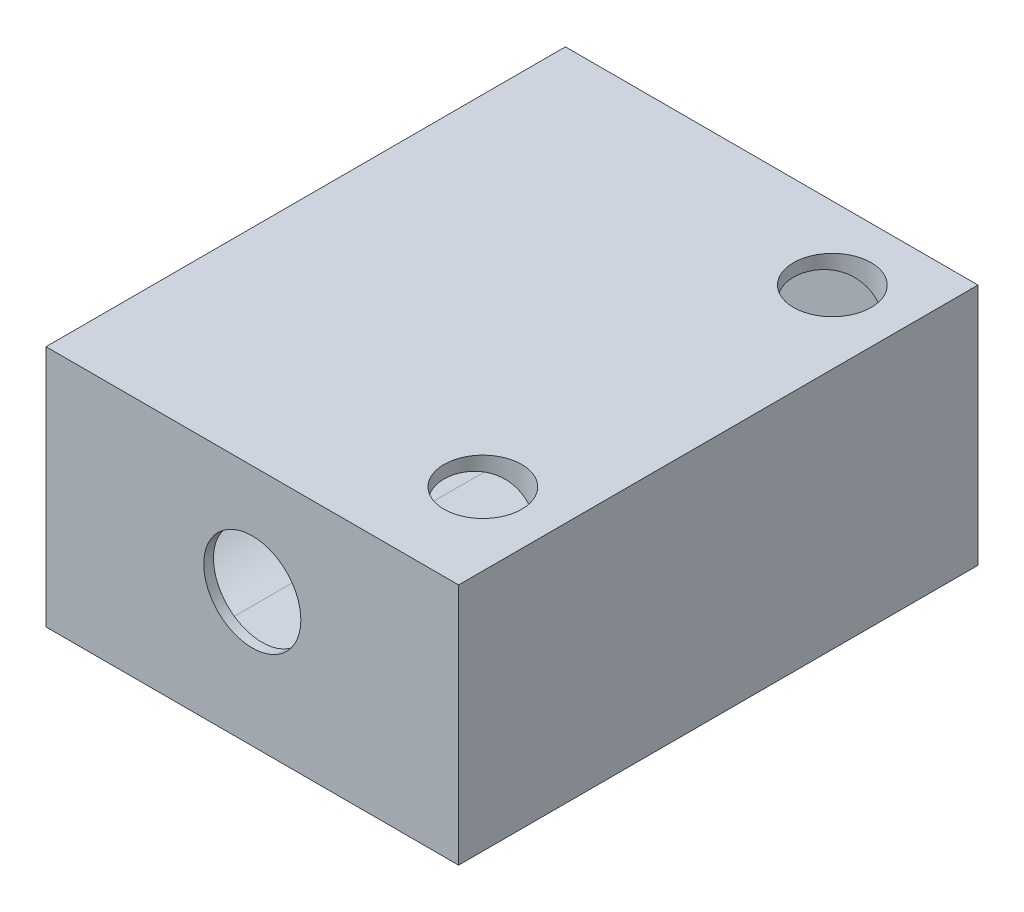
from build123d import *

# Parameters (mm, degrees)
SKETCH1_W               = 107.95
SKETCH1_H               = 63.5
BOSS_EXTRUDE5_DEPTH     = 133.35
SKETCH5_OUTSIDE_W       = 146.538
SKETCH5_OUTSIDE_H       = 102.088
SKETCH5_OUTSIDE_W_2     = 107.95
SKETCH5_OUTSIDE_H_2     = 63.5
CUT_EXTRUDE4_DEPTH      = 128.27
SKETCH6_W               = 107.95
SKETCH6_H               = 63.5
SKETCH6_R               = 12.7
BOSS_EXTRUDE6_DEPTH     = 2.54
CUT_EXTRUDE6_REACH      = 186.801
CUT_EXTRUDE6_END_RADIUS = 25.4
SKETCH8_R               = 10.16


with BuildPart() as part:
    # Sketch1 → Boss-Extrude5 (new body)
    with BuildSketch(Plane.XY):
        with Locations((53.975, 31.75)):
            Rectangle(SKETCH1_W, SKETCH1_H)
    extrude(amount=BOSS_EXTRUDE5_DEPTH)

    # Sketch5 outside → Cut-Extrude4 (cut)
    # profile 1 of 2: a face of its own
    with BuildSketch(Plane.XY.offset(133.35)):
        with Locations((53.975, 31.75)):
            Rectangle(SKETCH5_OUTSIDE_W, SKETCH5_OUTSIDE_H)
        with Locations((53.975, 31.75)):
            Rectangle(SKETCH5_OUTSIDE_W_2, SKETCH5_OUTSIDE_H_2, mode=Mode.SUBTRACT)
    # profile 2 of 2: a face of its own
    with BuildSketch(Plane.XY.offset(133.35)):
        with BuildLine():
            Line((31.75, 60.325), (76.2, 60.325))
            ThreePointArc((76.2, 60.325), (101.6, 34.925), (76.2, 9.525))
            Line((76.2, 9.525), (31.75, 9.525))
            ThreePointArc((31.75, 9.525), (6.35, 34.925), (31.75, 60.325))
        make_face()
    extrude(amount=-CUT_EXTRUDE4_DEPTH, mode=Mode.SUBTRACT)

    # Sketch6 → Boss-Extrude6 (add)
    with BuildSketch(Plane.XY.offset(133.35)):
        with Locations((53.975, 31.75)):
            Rectangle(SKETCH6_W, SKETCH6_H)
        with Locations((53.975, 34.925)):
            Circle(SKETCH6_R, mode=Mode.SUBTRACT)
    extrude(amount=BOSS_EXTRUDE6_DEPTH)

    # Cut-Extrude6: up to this cylinder (the profile starts outside it)
    cut_extrude6_end = Plane(origin=(76.2, 34.925, 64.77), z_dir=(0, 0, 1)) * Cylinder(CUT_EXTRUDE6_END_RADIUS, 516.842, mode=Mode.PRIVATE)
    # Sketch8 → Cut-Extrude6 (cut, up to the surface)
    with BuildSketch(Plane.XZ.offset(-63.5), mode=Mode.PRIVATE) as cut_extrude6_sk1:
        with Locations(Location((88.9, 19.05, 0), (0, 0, 90))):
            Circle(SKETCH8_R)
    cut_extrude6_tool1 = extrude(cut_extrude6_sk1.sketch, amount=CUT_EXTRUDE6_REACH, mode=Mode.PRIVATE) - cut_extrude6_end
    add(cut_extrude6_tool1.solids().sort_by_distance((88.9, 63.5, 19.05))[0], mode=Mode.SUBTRACT)
    # Sketch8 → Cut-Extrude6 (cut, up to the surface)
    with BuildSketch(Plane.XZ.offset(-63.5), mode=Mode.PRIVATE) as cut_extrude6_sk2:
        with Locations(Location((88.9, 110.49, 0), (0, 0, 90))):
            Circle(SKETCH8_R)
    cut_extrude6_tool2 = extrude(cut_extrude6_sk2.sketch, amount=CUT_EXTRUDE6_REACH, mode=Mode.PRIVATE) - cut_extrude6_end
    add(cut_extrude6_tool2.solids().sort_by_distance((88.9, 63.5, 110.49))[0], mode=Mode.SUBTRACT)


solid = part.part
